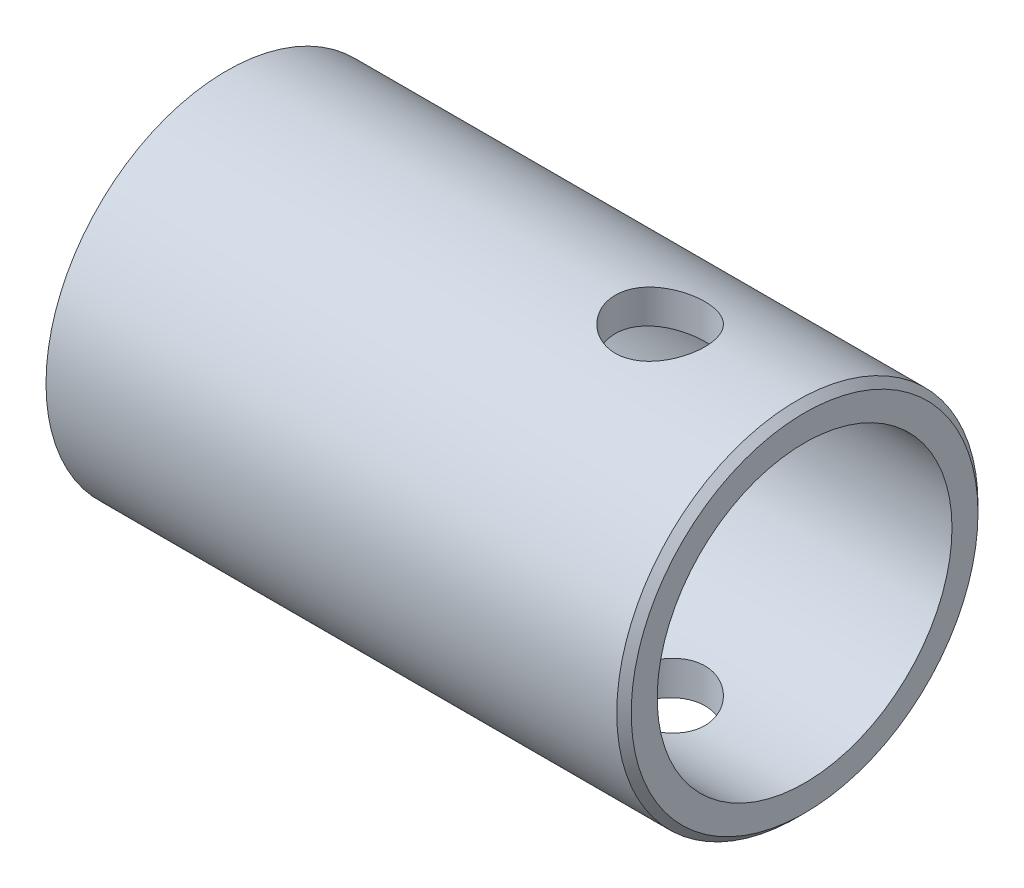
from build123d import *

# Parameters (mm, degrees)
SKETCH_1_R          = 12.5
SKETCH_1_R_2        = 10.2
EXTRUDE_1_DEPTH     = 30
EXTRUDE_START       = 10
SKETCH_2_R          = 12.5
EXTRUDE_2_DEPTH     = 10
SKETCH_3_R          = 3.1
CUT_EXTRUDE_1_DEPTH = 15
CHAMFER_1_SIZE      = 0.5
CUT_EXTRUDE_START   = -1
SKETCH_4_R          = 10.2
CUT_EXTRUDE_2_DEPTH = 1
SKETCH_5_R          = 1.05
CUT_EXTRUDE_3_DEPTH = 6


with BuildPart() as part:
    # 草图1 → 凸台-拉伸1 (new body)
    with BuildSketch(Plane(origin=(0, 0, 0), x_dir=(0, 0, -1), z_dir=(1, 0, 0))):
        Circle(SKETCH_1_R)
        Circle(SKETCH_1_R_2, mode=Mode.SUBTRACT)
    extrude(amount=EXTRUDE_1_DEPTH)

    # 草图2 → 凸台-拉伸2 (add)
    with BuildSketch(Plane.ZY.offset(EXTRUDE_START)):
        Circle(SKETCH_2_R)
    extrude(amount=-EXTRUDE_2_DEPTH)

    # 草图3 → 切除-拉伸1 (cut, symmetric)
    with BuildSketch(Plane(origin=(0, 0, 0), x_dir=(1, 0, 0), z_dir=(0, 1, 0))):
        with Locations(Location((20, 0, 0), (0, 0, 270))):
            Circle(SKETCH_3_R)
    extrude(amount=CUT_EXTRUDE_1_DEPTH, both=True, mode=Mode.SUBTRACT)

    # 倒角1
    chamfer_1_edges = [part.edges().sort_by_distance(p)[0] for p in [
        (30, 0, 12.5),
    ]]
    chamfer(chamfer_1_edges, length=CHAMFER_1_SIZE)

    # 草图4 → 切除-拉伸2 (cut)
    with BuildSketch(Plane(origin=(0, 0, 0), x_dir=(0, 0, -1), z_dir=(1, 0, 0)).offset(CUT_EXTRUDE_START)):
        Circle(SKETCH_4_R)
    extrude(amount=CUT_EXTRUDE_2_DEPTH, mode=Mode.SUBTRACT)

    # 草图5 → 切除-拉伸3 (cut)
    with BuildSketch(Plane.ZY.offset(10)):
        with Locations((9.53, 0)):
            Circle(SKETCH_5_R)
        with Locations((4.765, -8.253222098)):
            Circle(SKETCH_5_R)
        with Locations((-4.765, -8.253222098)):
            Circle(SKETCH_5_R)
        with Locations((-9.53, 0)):
            Circle(SKETCH_5_R)
        with Locations((-4.765, 8.253222098)):
            Circle(SKETCH_5_R)
        with Locations((4.765, 8.253222098)):
            Circle(SKETCH_5_R)
    extrude(amount=-CUT_EXTRUDE_3_DEPTH, mode=Mode.SUBTRACT)


solid = part.part
